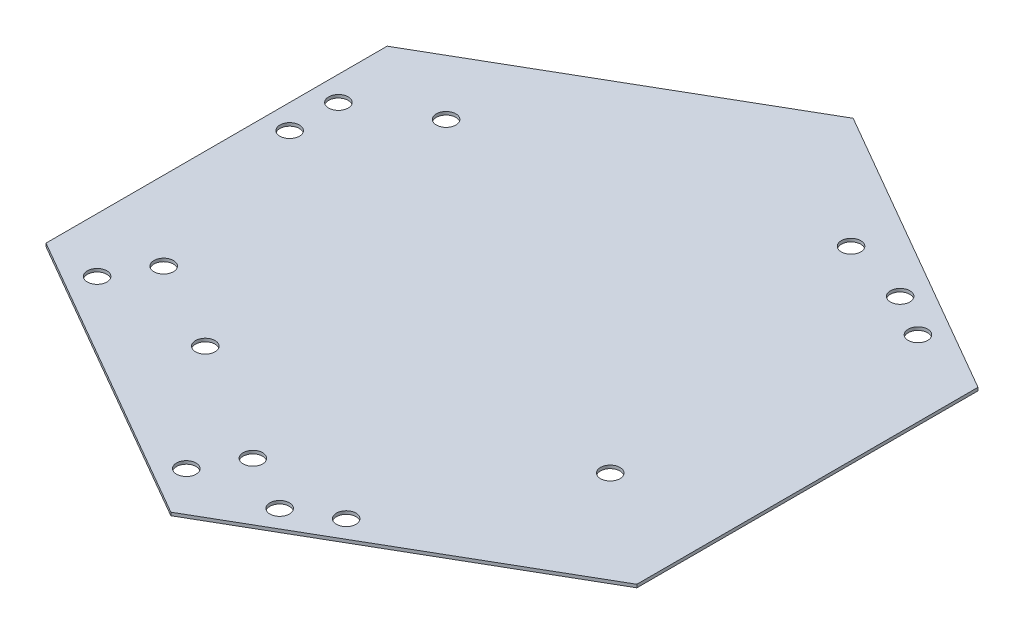
from build123d import *

# Parameters (mm, degrees)
SKETCH1_R           = 2.54
BOSS_EXTRUDE1_DEPTH = 0.8128
SKETCH2_R           = 2.54
CUT_EXTRUDE1_DEPTH  = 118.606454516
SKETCH3_R           = 2.54
CUT_EXTRUDE2_DEPTH  = 118.606454516


with BuildPart() as part:
    # Sketch1 → Boss-Extrude1 (new body)
    with BuildSketch(Plane(origin=(0, 0, 0), x_dir=(1, 0, 0), z_dir=(0, 1, 0))):
        Polygon((0, 88.9), (-76.989658396, 44.45), (-76.989658396, -44.45), (0, -88.9), (76.989658396, -44.45), (76.989658396, 44.45), align=None)
        with Locations(Location((13.322783942, -73.875738686, 0), (0, 0, 270))):
            Circle(SKETCH1_R, mode=Mode.SUBTRACT)
        with Locations(Location((24.32130657, -67.525738686, 0), (0, 0, 270))):
            Circle(SKETCH1_R, mode=Mode.SUBTRACT)
        with Locations(Location((-70.639658396, 12.7, 0), (0, 0, 270))):
            Circle(SKETCH1_R, mode=Mode.SUBTRACT)
        with Locations(Location((-70.639658396, 25.4, 0), (0, 0, 270))):
            Circle(SKETCH1_R, mode=Mode.SUBTRACT)
        with Locations(Location((46.318351826, 54.825738686, 0), (0, 0, 270))):
            Circle(SKETCH1_R, mode=Mode.SUBTRACT)
        with Locations(Location((57.316874454, 48.475738686, 0), (0, 0, 270))):
            Circle(SKETCH1_R, mode=Mode.SUBTRACT)
    extrude(amount=BOSS_EXTRUDE1_DEPTH)

    # Sketch2 → Cut-Extrude1 (cut, through all)
    with BuildSketch(Plane(origin=(0, 0.8128, 0), x_dir=(1, 0, 0), z_dir=(0, 1, 0))):
        with Locations(Location((28.620590949, 59.732317666, 0), (0, 0, 270))):
            Circle(SKETCH2_R)
        with Locations(Location((48.416295038, -22.82051708, 0), (0, 0, 270))):
            Circle(SKETCH2_R)
        with Locations(Location((-52.77011314, 35.59948292, 0), (0, 0, 270))):
            Circle(SKETCH2_R)
        with Locations(Location((-32.974409051, -46.953351826, 0), (0, 0, 270))):
            Circle(SKETCH2_R)
    extrude(amount=-CUT_EXTRUDE1_DEPTH, mode=Mode.SUBTRACT)

    # Sketch3 → Cut-Extrude2 (cut, through all)
    with BuildSketch(Plane(origin=(0, 0.8128, 0), x_dir=(1, 0, 0), z_dir=(0, 1, 0))):
        with Locations(Location((-7.823522628, -77.050738686, 0), (0, 0, 270))):
            Circle(SKETCH3_R)
        with Locations(Location((-62.816135768, -45.300738686, 0), (0, 0, 270))):
            Circle(SKETCH3_R)
        with Locations(Location((-56.466135768, -34.302216058, 0), (0, 0, 270))):
            Circle(SKETCH3_R)
        with Locations(Location((-1.473522628, -66.052216058, 0), (0, 0, 270))):
            Circle(SKETCH3_R)
    extrude(amount=-CUT_EXTRUDE2_DEPTH, mode=Mode.SUBTRACT)


solid = part.part
